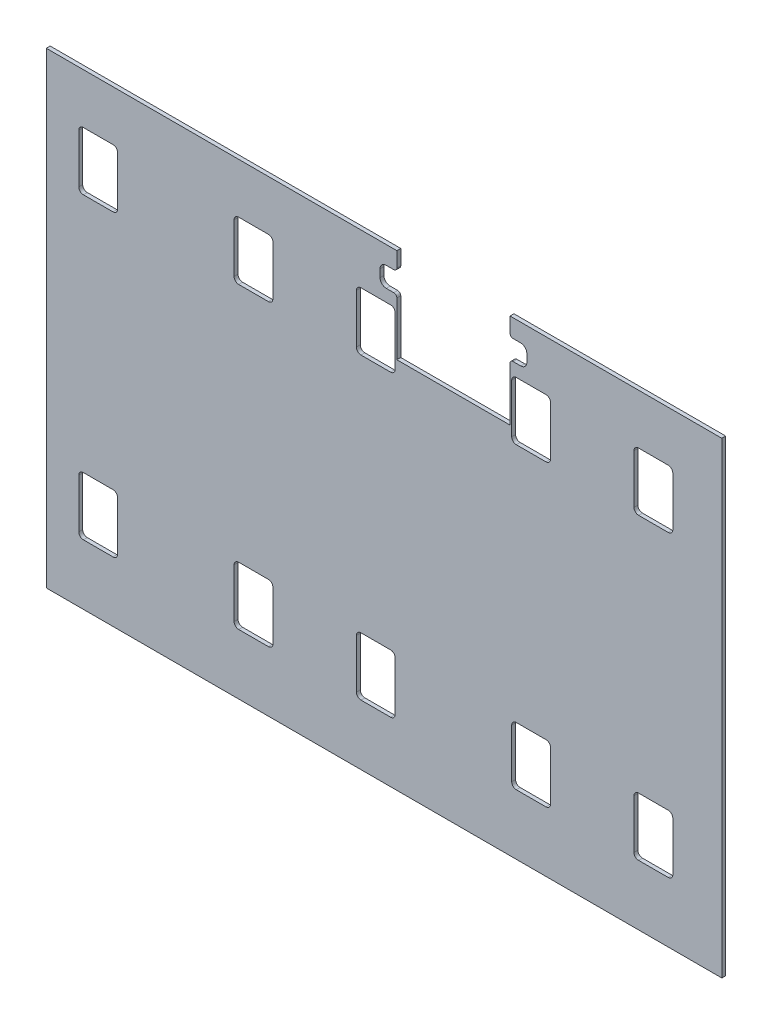
from build123d import *

# Parameters (mm, degrees)
SKETCH1_W           = 441.979400076
SKETCH1_H           = 305.81676
BOSS_EXTRUDE1_DEPTH = 2.54
CUT_EXTRUDE1_DEPTH  = 271.648139079
LPATTERN1_COUNT     = 3
LPATTERN1_PITCH     = 181.613999992
CUT_EXTRUDE2_DEPTH  = 271.648139079
LPATTERN2_COUNT     = 2
LPATTERN2_PITCH     = 181.613999992
CUT_EXTRUDE3_DEPTH  = 271.648139079


with BuildPart() as part:
    # Sketch1 → Boss-Extrude1 (new body)
    # profile 1 of 5: a face of its own
    with BuildSketch(Plane.XY):
        with Locations((0, -3.32067)):
            Rectangle(SKETCH1_W, SKETCH1_H)
        with BuildLine():
            ThreePointArc((-98.112625, -113.8), (-97.233945344, -115.921320344), (-95.112625, -116.8))
            Line((-95.112625, -116.8), (-75.712625, -116.8))
            ThreePointArc((-75.712625, -116.8), (-73.591304656, -115.921320344), (-72.712625, -113.8))
            Line((-72.712625, -113.8), (-72.712625, -81.7))
            ThreePointArc((-72.712625, -81.7), (-73.591304656, -79.578679656), (-75.712625, -78.7))
            Line((-75.712625, -78.7), (-95.112625, -78.7))
            ThreePointArc((-95.112625, -78.7), (-97.233945344, -79.578679656), (-98.112625, -81.7))
            Line((-98.112625, -81.7), (-98.112625, -113.8))
        make_face(mode=Mode.SUBTRACT)
        with BuildLine():
            ThreePointArc((-98.112625, 81.7), (-97.233945344, 79.578679656), (-95.112625, 78.7))
            Line((-95.112625, 78.7), (-75.712625, 78.7))
            ThreePointArc((-75.712625, 78.7), (-73.591304656, 79.578679656), (-72.712625, 81.7))
            Line((-72.712625, 81.7), (-72.712625, 113.8))
            ThreePointArc((-72.712625, 113.8), (-73.591304656, 115.921320344), (-75.712625, 116.8))
            Line((-75.712625, 116.8), (-95.112625, 116.8))
            ThreePointArc((-95.112625, 116.8), (-97.233945344, 115.921320344), (-98.112625, 113.8))
            Line((-98.112625, 113.8), (-98.112625, 81.7))
        make_face(mode=Mode.SUBTRACT)
        with BuildLine():
            ThreePointArc((-199.715375, -113.8), (-198.836695344, -115.921320344), (-196.715375, -116.8))
            Line((-196.715375, -116.8), (-177.315375, -116.8))
            ThreePointArc((-177.315375, -116.8), (-175.194054656, -115.921320344), (-174.315375, -113.8))
            Line((-174.315375, -113.8), (-174.315375, -81.7))
            ThreePointArc((-174.315375, -81.7), (-175.194054656, -79.578679656), (-177.315375, -78.7))
            Line((-177.315375, -78.7), (-196.715375, -78.7))
            ThreePointArc((-196.715375, -78.7), (-198.836695344, -79.578679656), (-199.715375, -81.7))
            Line((-199.715375, -81.7), (-199.715375, -113.8))
        make_face(mode=Mode.SUBTRACT)
        with BuildLine():
            ThreePointArc((-199.715375, 81.7), (-198.836695344, 79.578679656), (-196.715375, 78.7))
            Line((-196.715375, 78.7), (-177.315375, 78.7))
            ThreePointArc((-177.315375, 78.7), (-175.194054656, 79.578679656), (-174.315375, 81.7))
            Line((-174.315375, 81.7), (-174.315375, 113.8))
            ThreePointArc((-174.315375, 113.8), (-175.194054656, 115.921320344), (-177.315375, 116.8))
            Line((-177.315375, 116.8), (-196.715375, 116.8))
            ThreePointArc((-196.715375, 116.8), (-198.836695344, 115.921320344), (-199.715375, 113.8))
            Line((-199.715375, 113.8), (-199.715375, 81.7))
        make_face(mode=Mode.SUBTRACT)
    # profile 2 of 5: a face of its own
    with BuildSketch(Plane.XY):
        with BuildLine():
            Line((-199.715375, -113.8), (-199.715375, -81.7))
            ThreePointArc((-199.715375, -81.7), (-198.836695344, -79.578679656), (-196.715375, -78.7))
            Line((-196.715375, -78.7), (-177.315375, -78.7))
            ThreePointArc((-177.315375, -78.7), (-175.194054656, -79.578679656), (-174.315375, -81.7))
            Line((-174.315375, -81.7), (-174.315375, -113.8))
            ThreePointArc((-174.315375, -113.8), (-175.194054656, -115.921320344), (-177.315375, -116.8))
            Line((-177.315375, -116.8), (-196.715375, -116.8))
            ThreePointArc((-196.715375, -116.8), (-198.836695344, -115.921320344), (-199.715375, -113.8))
        make_face()
    # profile 3 of 5: a face of its own
    with BuildSketch(Plane.XY):
        with BuildLine():
            Line((-98.112625, -113.8), (-98.112625, -81.7))
            ThreePointArc((-98.112625, -81.7), (-97.233945344, -79.578679656), (-95.112625, -78.7))
            Line((-95.112625, -78.7), (-75.712625, -78.7))
            ThreePointArc((-75.712625, -78.7), (-73.591304656, -79.578679656), (-72.712625, -81.7))
            Line((-72.712625, -81.7), (-72.712625, -113.8))
            ThreePointArc((-72.712625, -113.8), (-73.591304656, -115.921320344), (-75.712625, -116.8))
            Line((-75.712625, -116.8), (-95.112625, -116.8))
            ThreePointArc((-95.112625, -116.8), (-97.233945344, -115.921320344), (-98.112625, -113.8))
        make_face()
    # profile 4 of 5: a face of its own
    with BuildSketch(Plane.XY):
        with BuildLine():
            Line((-199.715375, 113.8), (-199.715375, 81.7))
            ThreePointArc((-199.715375, 81.7), (-198.836695344, 79.578679656), (-196.715375, 78.7))
            Line((-196.715375, 78.7), (-177.315375, 78.7))
            ThreePointArc((-177.315375, 78.7), (-175.194054656, 79.578679656), (-174.315375, 81.7))
            Line((-174.315375, 81.7), (-174.315375, 113.8))
            ThreePointArc((-174.315375, 113.8), (-175.194054656, 115.921320344), (-177.315375, 116.8))
            Line((-177.315375, 116.8), (-196.715375, 116.8))
            ThreePointArc((-196.715375, 116.8), (-198.836695344, 115.921320344), (-199.715375, 113.8))
        make_face()
    # profile 5 of 5: a face of its own
    with BuildSketch(Plane.XY):
        with BuildLine():
            Line((-98.112625, 113.8), (-98.112625, 81.7))
            ThreePointArc((-98.112625, 81.7), (-97.233945344, 79.578679656), (-95.112625, 78.7))
            Line((-95.112625, 78.7), (-75.712625, 78.7))
            ThreePointArc((-75.712625, 78.7), (-73.591304656, 79.578679656), (-72.712625, 81.7))
            Line((-72.712625, 81.7), (-72.712625, 113.8))
            ThreePointArc((-72.712625, 113.8), (-73.591304656, 115.921320344), (-75.712625, 116.8))
            Line((-75.712625, 116.8), (-95.112625, 116.8))
            ThreePointArc((-95.112625, 116.8), (-97.233945344, 115.921320344), (-98.112625, 113.8))
        make_face()
    extrude(amount=BOSS_EXTRUDE1_DEPTH)

    # Sketch2 → Cut-Extrude1 (cut, through all)
    with BuildSketch(Plane.XY.offset(2.54)):
        with BuildLine():
            Line((-196.715375, 78.7), (-177.315375, 78.7))
            ThreePointArc((-177.315375, 78.7), (-175.194054656, 79.578679656), (-174.315375, 81.7))
            Line((-174.315375, 81.7), (-174.315375, 113.8))
            ThreePointArc((-174.315375, 113.8), (-175.194054656, 115.921320344), (-177.315375, 116.8))
            Line((-177.315375, 116.8), (-196.715375, 116.8))
            ThreePointArc((-196.715375, 116.8), (-198.836695344, 115.921320344), (-199.715375, 113.8))
            Line((-199.715375, 113.8), (-199.715375, 81.7))
            ThreePointArc((-199.715375, 81.7), (-198.836695344, 79.578679656), (-196.715375, 78.7))
        make_face()
        with BuildLine():
            Line((-199.715375, -81.7), (-199.715375, -113.8))
            ThreePointArc((-199.715375, -113.8), (-198.836695344, -115.921320344), (-196.715375, -116.8))
            Line((-196.715375, -116.8), (-177.315375, -116.8))
            ThreePointArc((-177.315375, -116.8), (-175.194054656, -115.921320344), (-174.315375, -113.8))
            Line((-174.315375, -113.8), (-174.315375, -81.7))
            ThreePointArc((-174.315375, -81.7), (-175.194054656, -79.578679656), (-177.315375, -78.7))
            Line((-177.315375, -78.7), (-196.715375, -78.7))
            ThreePointArc((-196.715375, -78.7), (-198.836695344, -79.578679656), (-199.715375, -81.7))
        make_face()
    cut_extrude1 = extrude(amount=-CUT_EXTRUDE1_DEPTH, mode=Mode.SUBTRACT)

    # LPattern1: Cut-Extrude1 ×3
    with Locations(*[(i * LPATTERN1_PITCH, 0, 0) for i in range(1, LPATTERN1_COUNT)]):
        add(cut_extrude1, mode=Mode.SUBTRACT)

    # Sketch3 → Cut-Extrude2 (cut, through all)
    with BuildSketch(Plane.XY.offset(2.54)):
        with BuildLine():
            Line((-72.712625, 81.7), (-72.712625, 113.8))
            ThreePointArc((-72.712625, 113.8), (-73.591304656, 115.921320344), (-75.712625, 116.8))
            Line((-75.712625, 116.8), (-95.112625, 116.8))
            ThreePointArc((-95.112625, 116.8), (-97.233945344, 115.921320344), (-98.112625, 113.8))
            Line((-98.112625, 113.8), (-98.112625, 81.7))
            ThreePointArc((-98.112625, 81.7), (-97.233945344, 79.578679656), (-95.112625, 78.7))
            Line((-95.112625, 78.7), (-75.712625, 78.7))
            ThreePointArc((-75.712625, 78.7), (-73.591304656, 79.578679656), (-72.712625, 81.7))
        make_face()
        with BuildLine():
            Line((-72.712625, -113.8), (-72.712625, -81.7))
            ThreePointArc((-72.712625, -81.7), (-73.591304656, -79.578679656), (-75.712625, -78.7))
            Line((-75.712625, -78.7), (-95.112625, -78.7))
            ThreePointArc((-95.112625, -78.7), (-97.233945344, -79.578679656), (-98.112625, -81.7))
            Line((-98.112625, -81.7), (-98.112625, -113.8))
            ThreePointArc((-98.112625, -113.8), (-97.233945344, -115.921320344), (-95.112625, -116.8))
            Line((-95.112625, -116.8), (-75.712625, -116.8))
            ThreePointArc((-75.712625, -116.8), (-73.591304656, -115.921320344), (-72.712625, -113.8))
        make_face()
    cut_extrude2 = extrude(amount=-CUT_EXTRUDE2_DEPTH, mode=Mode.SUBTRACT)

    # LPattern2: Cut-Extrude2 ×2
    with Locations(*[(i * LPATTERN2_PITCH, 0, 0) for i in range(1, LPATTERN2_COUNT)]):
        add(cut_extrude2, mode=Mode.SUBTRACT)

    # Sketch5 → Cut-Extrude3 (cut, through all)
    with BuildSketch(Plane.XY.offset(2.54)):
        with BuildLine():
            ThreePointArc((8.383999992, 139.78771), (7.802899846, 138.384810146), (6.399999992, 137.80371))
            Line((6.399999992, 137.80371), (1.399999992, 137.80371))
            ThreePointArc((1.399999992, 137.80371), (-1.439740841, 136.627450833), (-2.616000008, 133.78771))
            Line((-2.616000008, 133.78771), (-2.616000008, 128.78771))
            ThreePointArc((-2.616000008, 128.78771), (-1.439740841, 125.947969167), (1.399999992, 124.77171))
            Line((1.399999992, 124.77171), (6.399999992, 124.77171))
            ThreePointArc((6.399999992, 124.77171), (7.802899846, 124.190609854), (8.383999992, 122.78771))
            Line((8.383999992, 122.78771), (8.383999992, 87.77171))
            Line((8.383999992, 87.77171), (82.415999992, 87.77171))
            Line((82.415999992, 87.77171), (82.415999992, 122.78771))
            ThreePointArc((82.415999992, 122.78771), (82.997100138, 124.190609854), (84.399999992, 124.77171))
            Line((84.399999992, 124.77171), (89.399999992, 124.77171))
            ThreePointArc((89.399999992, 124.77171), (92.239740825, 125.947969167), (93.415999992, 128.78771))
            Line((93.415999992, 128.78771), (93.415999992, 133.78771))
            ThreePointArc((93.415999992, 133.78771), (92.239740825, 136.627450833), (89.399999992, 137.80371))
            Line((89.399999992, 137.80371), (84.399999992, 137.80371))
            ThreePointArc((84.399999992, 137.80371), (82.997100138, 138.384810146), (82.415999992, 139.78771))
            Line((82.415999992, 139.78771), (82.415999992, 149.80371))
            Line((82.415999992, 149.80371), (8.383999992, 149.80371))
            Line((8.383999992, 149.80371), (8.383999992, 139.78771))
        make_face()
    extrude(amount=-CUT_EXTRUDE3_DEPTH, mode=Mode.SUBTRACT)


solid = part.part
